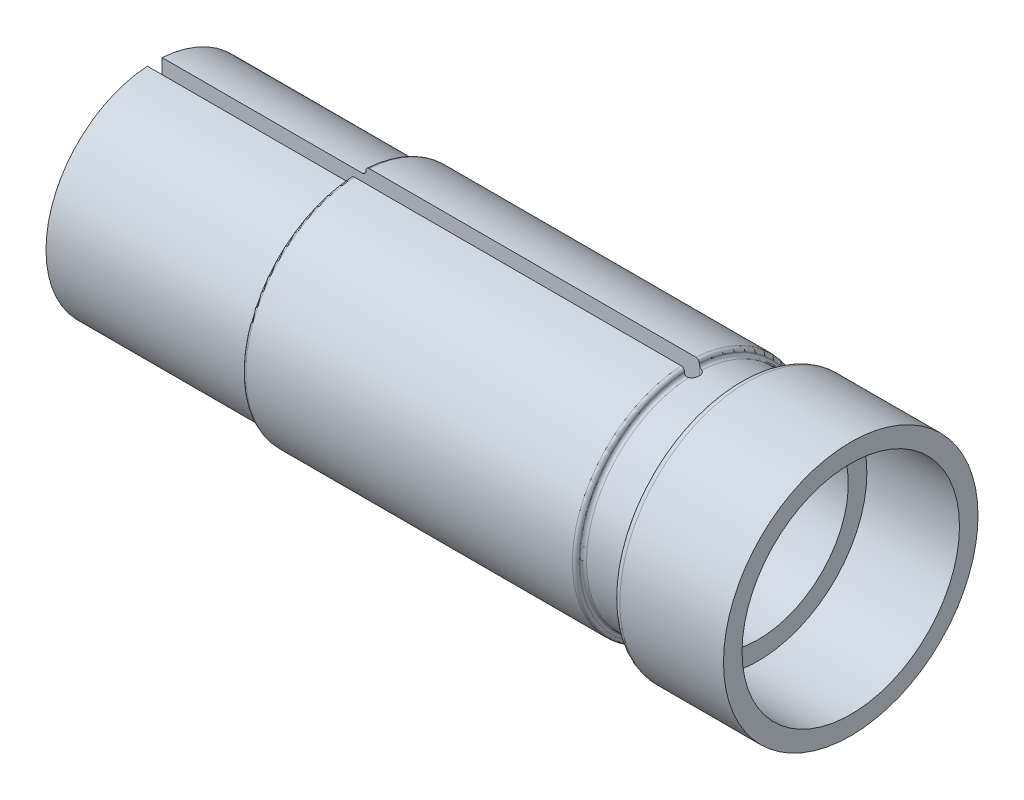
from build123d import *

# Parameters (mm, degrees)
CUT_EXTRUDE3_START = 2.426772
CUT_EXTRUDE3_DEPTH = 0.708228
SKETCH6_R          = 3.435
SKETCH6_R_2        = 2.935
CUT_EXTRUDE4_DEPTH = 2


with BuildPart() as part:
    # Sketch4 → Revolve2 (revolve)
    with BuildSketch(Plane.XY, mode=Mode.PRIVATE) as revolve2_sk:
        with BuildLine():
            Line((10.79, 2.935), (6.29, 2.935))
            Line((6.29, 2.935), (6.29, 2.435))
            Line((6.29, 2.435), (4, 2.435))
            Line((4, 2.435), (4, 2.635))
            Line((4, 2.635), (-4, 2.635))
            Line((-4, 2.635), (-4, 2.435))
            Line((-4, 2.435), (-10, 2.435))
            Line((-10, 2.435), (-10, 2.935))
            Line((-10, 2.935), (-4.59, 2.935))
            ThreePointArc((-4.59, 2.935), (-4.52636039, 2.96136039), (-4.5, 3.025))
            Line((-4.5, 3.025), (-4.5, 3.045))
            ThreePointArc((-4.5, 3.045), (-4.47363961, 3.10863961), (-4.41, 3.135))
            Line((-4.41, 3.135), (4.41, 3.135))
            ThreePointArc((4.41, 3.135), (4.47363961, 3.10863961), (4.5, 3.045))
            Line((4.5, 3.045), (4.5, 3.025))
            ThreePointArc((4.5, 3.025), (4.52636039, 2.96136039), (4.59, 2.935))
            Line((4.59, 2.935), (5.59, 2.935))
            ThreePointArc((5.59, 2.935), (5.731421356, 2.993578644), (5.79, 3.135))
            Line((5.79, 3.135), (5.79, 3.235))
            ThreePointArc((5.79, 3.235), (5.848578644, 3.376421356), (5.99, 3.435))
            Line((5.99, 3.435), (10.79, 3.435))
            Line((10.79, 3.435), (10.79, 2.935))
        make_face()
    revolve(revolve2_sk.sketch.rotate(Axis((-16.2, 0, 0), (1, 0, 0)), 90), axis=Axis((-16.2, 0, 0), (1, 0, 0)))

    # Sketch5 → Cut-Extrude3 (cut)
    with BuildSketch(Plane(origin=(0, 0, 0), x_dir=(1, 0, 0), z_dir=(0, 1, 0)).offset(CUT_EXTRUDE3_START)):
        with BuildLine():
            Line((-10, 0.2), (4.5, 0.2))
            ThreePointArc((4.5, 0.2), (4.7, 0), (4.5, -0.2))
            Line((4.5, -0.2), (-10, -0.2))
            Line((-10, -0.2), (-10, 0.2))
        make_face()
    extrude(amount=CUT_EXTRUDE3_DEPTH, mode=Mode.SUBTRACT)

    # Sketch6 → Cut-Extrude4 (cut)
    with BuildSketch(Plane(origin=(10.79, 0, 0), x_dir=(0, 0, -1), z_dir=(1, 0, 0))):
        with Locations(Location((0, 0, 0), (0, 0, 180))):
            Circle(SKETCH6_R)
        with Locations(Location((0, 0, 0), (0, 0, 180))):
            Circle(SKETCH6_R_2, mode=Mode.SUBTRACT)
    extrude(amount=-CUT_EXTRUDE4_DEPTH, mode=Mode.SUBTRACT)


solid = part.part
